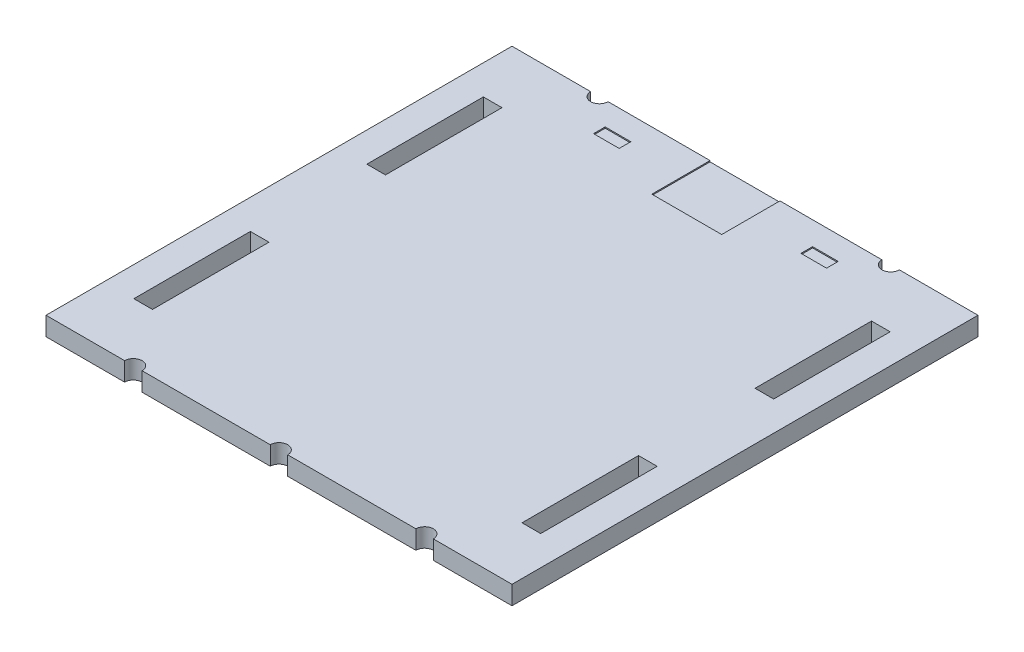
from build123d import *

# Parameters (mm, degrees)
SKETCH_1_W              = 40
SKETCH_1_H              = 40
EXTRUDE_1_DEPTH         = 1.6
HOLE_WIZARD_1_5_1_5_1_D = 1.5
SKETCH_8_W              = 1.6
SKETCH_8_H              = 10
CUT_EXTRUDE_2_DEPTH     = 57.591165388
SKETCH_9_W              = 2.2
SKETCH_9_H              = 1
SKETCH_9_W_2            = 6
SKETCH_9_H_2            = 5
CUT_EXTRUDE_3_DEPTH     = 0.1
SKETCH_10_W             = 2.2
SKETCH_10_H             = 1
CUT_EXTRUDE_4_DEPTH     = 0.1
SKETCH_11_W             = 0.7
SKETCH_11_H             = 1.5
CUT_EXTRUDE_5_DEPTH     = 0.1


with BuildPart() as part:
    # 스케치1 → 보스-돌출1 (new body)
    with BuildSketch(Plane(origin=(0, 0, 0), x_dir=(1, 0, 0), z_dir=(0, 1, 0))):
        with Locations((20, 20)):
            Rectangle(SKETCH_1_W, SKETCH_1_H)
    extrude(amount=EXTRUDE_1_DEPTH)

    # Ø1.5 (1.5) 지름 구멍1 (through all)
    with Locations(Plane(origin=(0, 1.6, 0), x_dir=(1, 0, 0), z_dir=(0, 1, 0))):
        with Locations((7.5, 0), (7.5, 40), (20, 0), (32.5, 0), (32.5, 40)):
            Hole(HOLE_WIZARD_1_5_1_5_1_D / 2)

    # 스케치8 → 컷-돌출2 (cut, through all)
    with BuildSketch(Plane(origin=(0, 1.6, 0), x_dir=(1, 0, 0), z_dir=(0, 1, 0))):
        with Locations((3.34, 10)):
            Rectangle(SKETCH_8_W, SKETCH_8_H)
        with Locations((3.34, 30)):
            Rectangle(SKETCH_8_W, SKETCH_8_H)
        with Locations((36.66, 10)):
            Rectangle(SKETCH_8_W, SKETCH_8_H)
        with Locations((36.66, 30)):
            Rectangle(SKETCH_8_W, SKETCH_8_H)
    extrude(amount=-CUT_EXTRUDE_2_DEPTH, mode=Mode.SUBTRACT)

    # 스케치9 → 컷-돌출3 (cut)
    with BuildSketch(Plane(origin=(0, 1.6, 0), x_dir=(1, 0, 0), z_dir=(0, 1, 0))):
        with Locations((11.1, 37.5)):
            Rectangle(SKETCH_9_W, SKETCH_9_H)
        with Locations((28.9, 37.5)):
            Rectangle(SKETCH_9_W, SKETCH_9_H)
        with Locations((20, 37.5)):
            Rectangle(SKETCH_9_W_2, SKETCH_9_H_2)
    extrude(amount=-CUT_EXTRUDE_3_DEPTH, mode=Mode.SUBTRACT)

    # 스케치10 → 컷-돌출4 (cut)
    with BuildSketch(Plane.XZ):
        with Locations((11.1, -37.5)):
            Rectangle(SKETCH_10_W, SKETCH_10_H)
        with Locations((28.9, -37.5)):
            Rectangle(SKETCH_10_W, SKETCH_10_H)
    extrude(amount=-CUT_EXTRUDE_4_DEPTH, mode=Mode.SUBTRACT)

    # 스케치11 → 컷-돌출5 (cut)
    with BuildSketch(Plane.XZ):
        with Locations((12.38, -3.75)):
            Rectangle(SKETCH_11_W, SKETCH_11_H)
        with Locations((13.65, -3.75)):
            Rectangle(SKETCH_11_W, SKETCH_11_H)
        with Locations((14.92, -3.75)):
            Rectangle(SKETCH_11_W, SKETCH_11_H)
        with Locations((16.19, -3.75)):
            Rectangle(SKETCH_11_W, SKETCH_11_H)
        with Locations((17.46, -3.75)):
            Rectangle(SKETCH_11_W, SKETCH_11_H)
        with Locations((18.73, -3.75)):
            Rectangle(SKETCH_11_W, SKETCH_11_H)
        with Locations((20, -3.75)):
            Rectangle(SKETCH_11_W, SKETCH_11_H)
        with Locations((21.27, -3.75)):
            Rectangle(SKETCH_11_W, SKETCH_11_H)
        with Locations((22.54, -3.75)):
            Rectangle(SKETCH_11_W, SKETCH_11_H)
        with Locations((23.81, -3.75)):
            Rectangle(SKETCH_11_W, SKETCH_11_H)
        with Locations((25.08, -3.75)):
            Rectangle(SKETCH_11_W, SKETCH_11_H)
        with Locations((26.35, -3.75)):
            Rectangle(SKETCH_11_W, SKETCH_11_H)
        with Locations((27.62, -3.75)):
            Rectangle(SKETCH_11_W, SKETCH_11_H)
    extrude(amount=-CUT_EXTRUDE_5_DEPTH, mode=Mode.SUBTRACT)


solid = part.part
